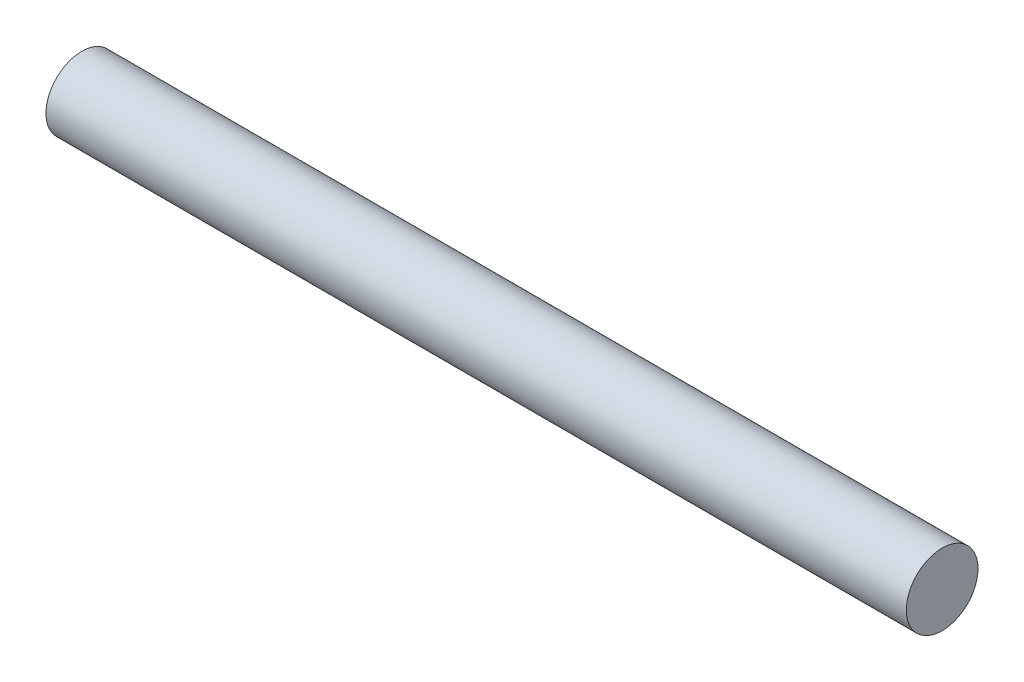
from build123d import *

# Parameters (mm, degrees)
SUSP_RACK_HOUSING_PROFILE_R = 20


with BuildPart() as part:
    # SUSP_rack_housing: sweep along a curve in space
    with BuildLine() as susp_rack_housing_path:
        Line((-240, -90.4, -82.3915), (240, -90.4, -82.3915))
    # SUSP_rack_housing profile (on start of the path) → SUSP_rack_housing (sweep)
    with BuildSketch(Plane(origin=(-240, -90.4, -82.3915), x_dir=(0, 0, 1), z_dir=(1, 0, 0))):
        Circle(SUSP_RACK_HOUSING_PROFILE_R)
    sweep(path=susp_rack_housing_path.line)


solid = part.part
